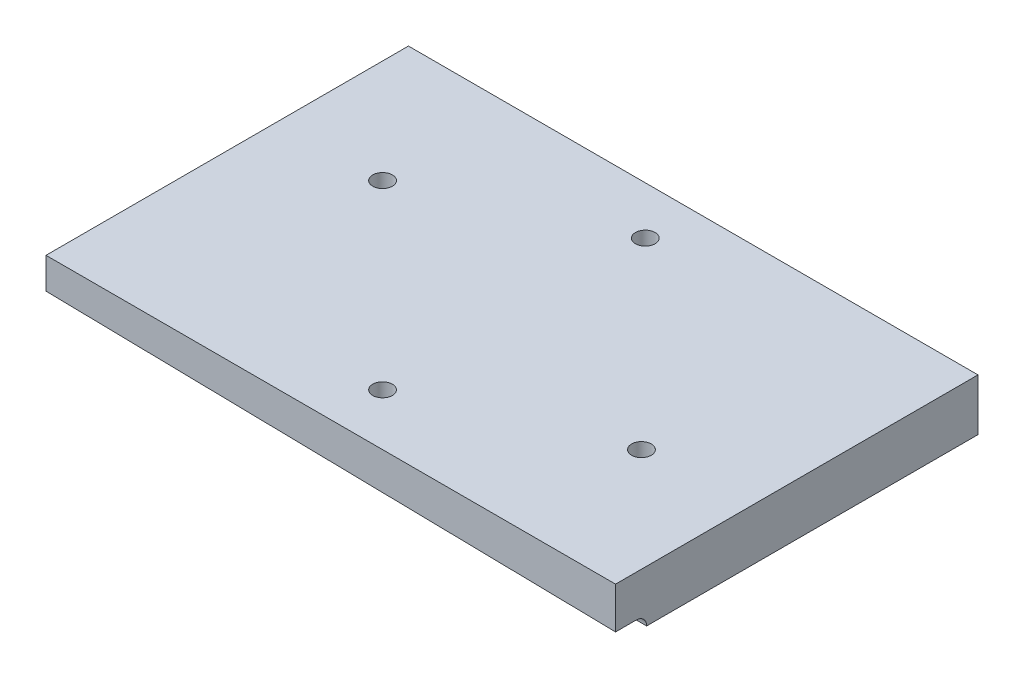
from build123d import *

# Parameters (mm, degrees)
SKETCH1_W           = 110
SKETCH1_H           = 70
BOSS_EXTRUDE1_DEPTH = 10
SKETCH5_R           = 1.9
CUT_EXTRUDE4_DEPTH  = 77.548290163
CUT_EXTRUDE6_DEPTH  = 6
SKETCH17_R          = 1.9
CUT_EXTRUDE8_DEPTH  = 77.548290163
FILLET1_R           = 2
SKETCH24_R          = 1.9
CUT_EXTRUDE12_DEPTH = 77.548290163
SKETCH25_R          = 1.9
CUT_EXTRUDE13_DEPTH = 77.548290163


with BuildPart() as part:
    # Sketch1 → Boss-Extrude1 (new body)
    with BuildSketch(Plane(origin=(0, 0, 0), x_dir=(1, 0, 0), z_dir=(0, 1, 0))):
        with Locations((9.869408673, 4.390361071)):
            Rectangle(SKETCH1_W, SKETCH1_H)
    extrude(amount=BOSS_EXTRUDE1_DEPTH)

    # Sketch5 → Cut-Extrude4 (cut, through all)
    with BuildSketch(Plane(origin=(0, 10, 0), x_dir=(1, 0, 0), z_dir=(0, 1, 0))):
        with Locations(Location((9.869408673, -20.609638929, 0), (0, 0, 270))):
            Circle(SKETCH5_R)
    extrude(amount=-CUT_EXTRUDE4_DEPTH, mode=Mode.SUBTRACT)

    # Sketch14 → Cut-Extrude6 (cut)
    with BuildSketch(Plane.XY.offset(30.609638929)):
        Polygon((-45.130591327, 0), (-45.130591327, 4), (64.869408673, 2), (64.869408673, 0), align=None)
    extrude(amount=-CUT_EXTRUDE6_DEPTH, mode=Mode.SUBTRACT)

    # Sketch17 → Cut-Extrude8 (cut, through all)
    with BuildSketch(Plane(origin=(0, 0, 0), x_dir=(-1, 0, 0), z_dir=(0, -1, 0))):
        with Locations(Location((-9.869408673, 30.128732458, 0), (0, 0, 90))):
            Circle(SKETCH17_R)
    extrude(amount=-CUT_EXTRUDE8_DEPTH, mode=Mode.SUBTRACT)

    # Fillet1
    fillet1_edges = [part.edges().sort_by_distance(p)[0] for p in [
        (9.869408673, 3, 24.609638929),
    ]]
    fillet(fillet1_edges, radius=FILLET1_R)

    # Sketch24 → Cut-Extrude12 (cut, through all)
    with BuildSketch(Plane.XZ):
        with Locations(Location((44.869408673, 5.609638929, 0), (0, 0, 270))):
            Circle(SKETCH24_R)
    extrude(amount=-CUT_EXTRUDE12_DEPTH, mode=Mode.SUBTRACT)

    # Sketch25 → Cut-Extrude13 (cut, through all)
    with BuildSketch(Plane.XZ):
        with Locations(Location((-25.130591327, -14.390361071, 0), (0, 0, 270))):
            Circle(SKETCH25_R)
    extrude(amount=-CUT_EXTRUDE13_DEPTH, mode=Mode.SUBTRACT)


solid = part.part
